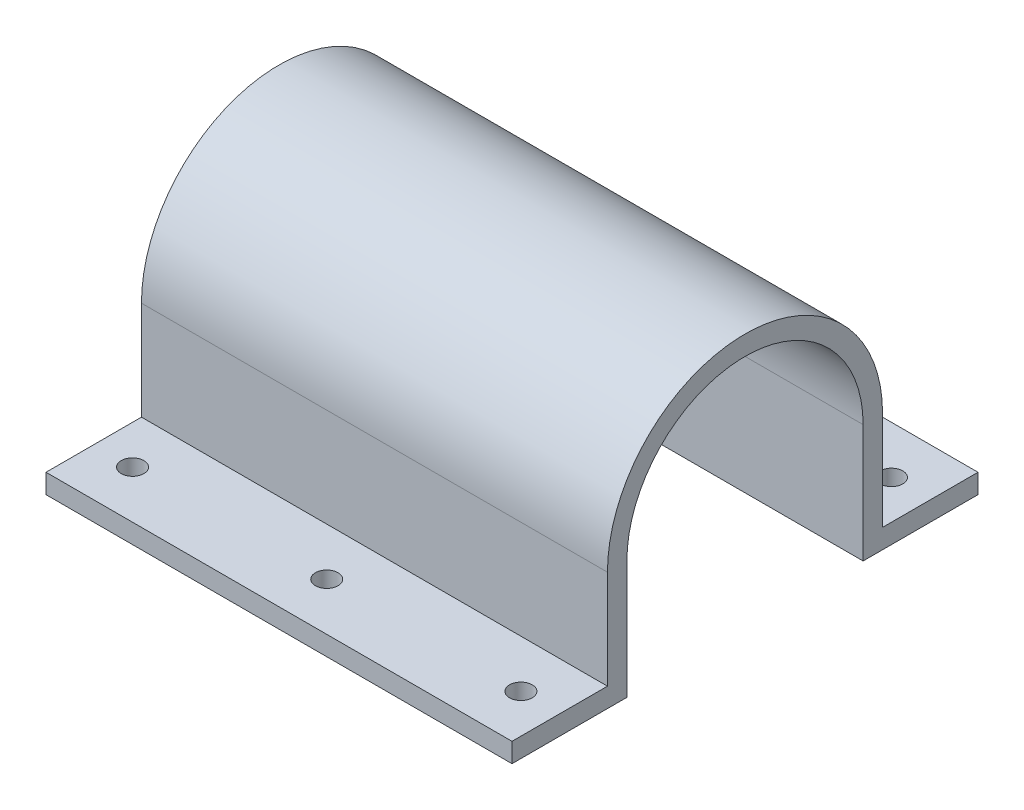
from build123d import *

# Parameters (mm, degrees)
BOSS_EXTRUDE1_DEPTH = 72
SKETCH2_R           = 11.25
SKETCH2_R_2         = 1.75
BOSS_EXTRUDE2_DEPTH = 3
SKETCH3_R           = 1.75
CUT_EXTRUDE1_DEPTH  = 89.386933423


with BuildPart() as part:
    # Sketch1 → Boss-Extrude1 (new body)
    with BuildSketch(Plane(origin=(0, 0, 0), x_dir=(0, 0, -1), z_dir=(1, 0, 0))):
        with BuildLine():
            Line((18.25, 0), (18.25, -18.25))
            Line((18.25, -18.25), (36, -18.25))
            Line((36, -18.25), (36, -15.25))
            Line((36, -15.25), (21.25, -15.25))
            Line((21.25, -15.25), (21.25, 0))
            ThreePointArc((21.25, 0), (0, 21.25), (-21.25, 0))
            Line((-21.25, 0), (-21.25, -15.25))
            Line((-21.25, -15.25), (-36, -15.25))
            Line((-36, -15.25), (-36, -18.25))
            Line((-36, -18.25), (-18.25, -18.25))
            Line((-18.25, -18.25), (-18.25, 0))
            ThreePointArc((-18.25, 0), (0, 18.25), (18.25, 0))
        make_face()
    extrude(amount=BOSS_EXTRUDE1_DEPTH)

    # Sketch2 → Boss-Extrude2 (add)
    with BuildSketch(Plane.ZY):
        with BuildLine():
            Line((-18.25, -18.25), (18.25, -18.25))
            Line((18.25, -18.25), (18.25, 0))
            ThreePointArc((18.25, 0), (0, 18.25), (-18.25, 0))
            Line((-18.25, 0), (-18.25, -18.25))
        make_face()
        Circle(SKETCH2_R, mode=Mode.SUBTRACT)
        with Locations((-15, 0)):
            Circle(SKETCH2_R_2, mode=Mode.SUBTRACT)
        with Locations((0, 15)):
            Circle(SKETCH2_R_2, mode=Mode.SUBTRACT)
        with Locations((15, 0)):
            Circle(SKETCH2_R_2, mode=Mode.SUBTRACT)
        with Locations((0, -15)):
            Circle(SKETCH2_R_2, mode=Mode.SUBTRACT)
    extrude(amount=-BOSS_EXTRUDE2_DEPTH)

    # Sketch3 → Cut-Extrude1 (cut, through all)
    with BuildSketch(Plane(origin=(0, -15.25, 0), x_dir=(1, 0, 0), z_dir=(0, 1, 0))):
        with Locations(Location((36, 28.625, 0), (0, 0, 270))):
            Circle(SKETCH3_R)
        with Locations(Location((6, 28.625, 0), (0, 0, 270))):
            Circle(SKETCH3_R)
        with Locations(Location((66, 28.625, 0), (0, 0, 270))):
            Circle(SKETCH3_R)
        with Locations(Location((66, -28.625, 0), (0, 0, 90))):
            Circle(SKETCH3_R)
        with Locations(Location((36, -28.625, 0), (0, 0, 90))):
            Circle(SKETCH3_R)
        with Locations(Location((6, -28.625, 0), (0, 0, 90))):
            Circle(SKETCH3_R)
    extrude(amount=-CUT_EXTRUDE1_DEPTH, mode=Mode.SUBTRACT)


solid = part.part
